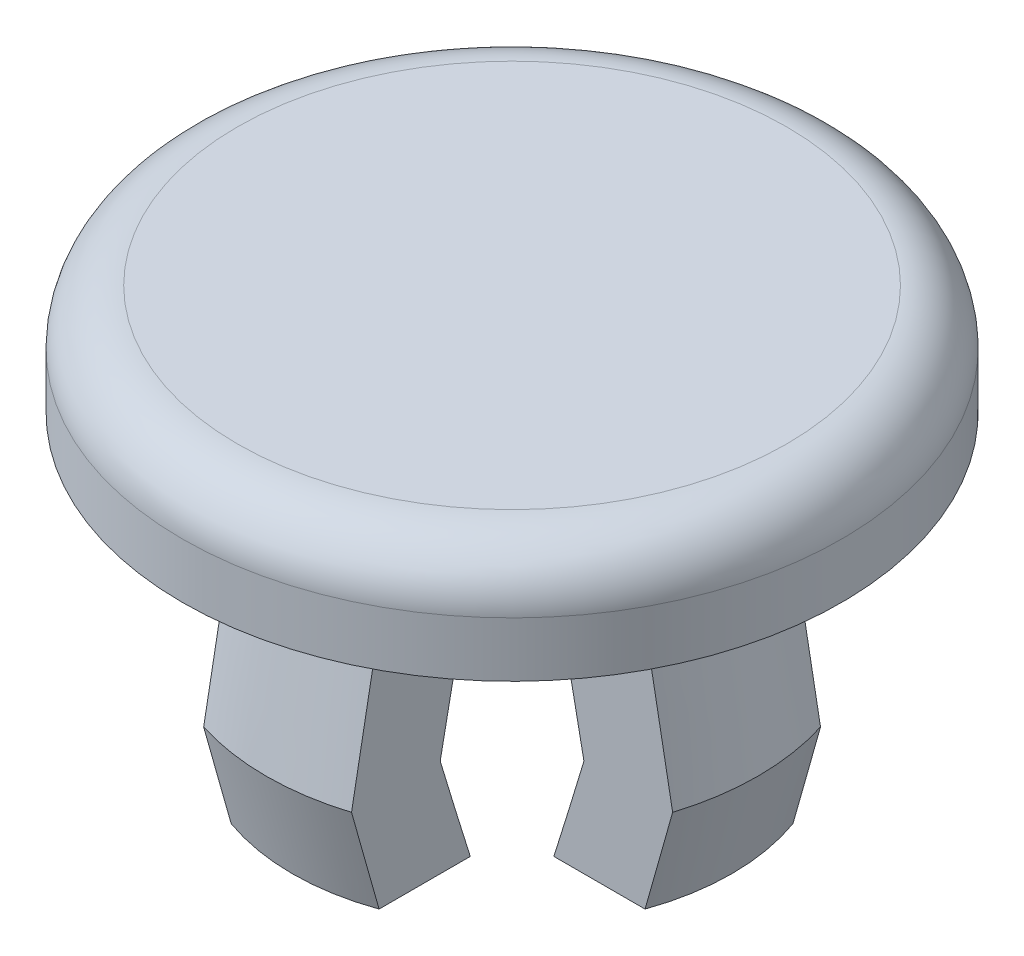
from build123d import *

# Parameters (mm, degrees)
CUT_EXTRUDE1_DEPTH = 10.992209668


with BuildPart() as part:
    # Sketch1 → Revolve1 (revolve)
    with BuildSketch(Plane.XY, mode=Mode.PRIVATE) as revolve1_sk:
        with BuildLine():
            Line((0, 2), (-5, 2))
            ThreePointArc((-5, 2), (-5.707106781, 1.707106781), (-6, 1))
            Line((-6, 1), (-6, 0))
            Line((-6, 0), (0, 0))
            Line((0, 0), (0, 2))
        make_face()
    revolve(revolve1_sk.sketch.rotate(Axis((0, 2, 0), (0, -1, 0)), 270), axis=Axis((0, 2, 0), (0, -1, 0)))

    # Sketch2 → Revolve2 (revolve)
    with BuildSketch(Plane.XY, mode=Mode.PRIVATE) as revolve2_sk:
        Polygon((-4.476082848, -3.5), (-3.858938415, 0), (-2.358938415, 0), (-2.976082848, -3.5), (-2.5, -5.276765377), (-4, -5.276765377), align=None)
    revolve(revolve2_sk.sketch.rotate(Axis((0, -3.5, 0), (0, 1, 0)), 270), axis=Axis((0, -3.5, 0), (0, 1, 0)))

    # Sketch3 → Cut-Extrude1 (cut, through all)
    with BuildSketch(Plane(origin=(0, 0, 0), x_dir=(1, 0, 0), z_dir=(0, 1, 0))):
        with BuildLine():
            Line((-4.268916085, 1.345984071), (-1.345984071, 1.345984071))
            Line((-1.345984071, 1.345984071), (-1.345984071, 4.268916085))
            ThreePointArc((-1.345984071, 4.268916085), (-3.165068535, 3.165068535), (-4.268916085, 1.345984071))
        make_face()
        with BuildLine():
            Line((1.345984071, 1.345984071), (4.268916085, 1.345984071))
            ThreePointArc((4.268916085, 1.345984071), (3.165068535, 3.165068535), (1.345984071, 4.268916085))
            Line((1.345984071, 4.268916085), (1.345984071, 1.345984071))
        make_face()
        with BuildLine():
            Line((-1.345984071, -1.345984071), (-4.268916085, -1.345984071))
            ThreePointArc((-4.268916085, -1.345984071), (-3.165068535, -3.165068535), (-1.345984071, -4.268916085))
            Line((-1.345984071, -4.268916085), (-1.345984071, -1.345984071))
        make_face()
        with BuildLine():
            Line((1.345984071, -1.345984071), (1.345984071, -4.268916085))
            ThreePointArc((1.345984071, -4.268916085), (3.165068535, -3.165068535), (4.268916085, -1.345984071))
            Line((4.268916085, -1.345984071), (1.345984071, -1.345984071))
        make_face()
    extrude(amount=-CUT_EXTRUDE1_DEPTH, mode=Mode.SUBTRACT)


solid = part.part
